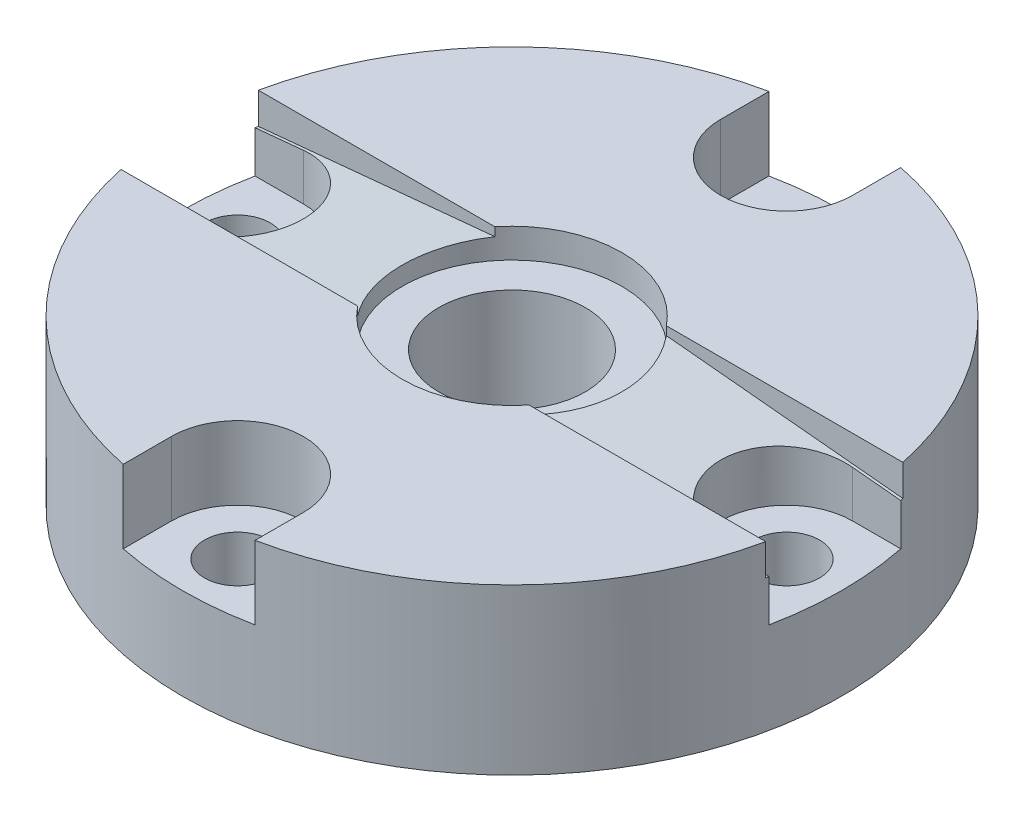
from build123d import *

# Parameters (mm, degrees)
ESQUISSE1_R                  = 90
BOSS_EXTRU_1_DEPTH           = 45
ESQUISSE2_R                  = 9
ENL_V_MAT_EXTRU_1_DEPTH      = 45
ESQUISSE2_3_R                = 9
ENL_V_MAT_EXTRU_2_DEPTH      = 20
ENL_V_MAT_EXTRU_3_DEPTH      = 18.75
R_P_TITION_CIRCULAIRE2_COUNT = 4
ESQUISSE4_R                  = 30
ENL_V_MAT_EXTRU_4_DEPTH      = 8
ESQUISSE4_3_R                = 20
ENL_V_MAT_EXTRU_5_DEPTH      = 136


with BuildPart() as part:
    # Esquisse1 → Boss.-Extru.1 (new body)
    with BuildSketch(Plane(origin=(0, 0, 0), x_dir=(1, 0, 0), z_dir=(0, 1, 0))):
        Circle(ESQUISSE1_R)
    extrude(amount=BOSS_EXTRU_1_DEPTH)

    # Esquisse2 → Enlèv. mat.-Extru.1 (cut)
    with BuildSketch(Plane(origin=(0, 45, 0), x_dir=(1, 0, 0), z_dir=(0, 1, 0))):
        with Locations((75, 0)):
            Circle(ESQUISSE2_R)
    enl_v_mat_extru_1 = extrude(amount=-ENL_V_MAT_EXTRU_1_DEPTH, mode=Mode.SUBTRACT)

    # Esquisse2<3> → Enlèv. mat.-Extru.2 (cut)
    with BuildSketch(Plane(origin=(0, 45, 0), x_dir=(1, 0, 0), z_dir=(0, 1, 0))):
        with BuildLine():
            Line((75, 18), (115, 18))
            ThreePointArc((115, 18), (133, 0), (115, -18))
            Line((115, -18), (75, -18))
            ThreePointArc((75, -18), (57, 0), (75, 18))
        make_face()
        with Locations((75, 0)):
            Circle(ESQUISSE2_3_R, mode=Mode.SUBTRACT)
    enl_v_mat_extru_2 = extrude(amount=-ENL_V_MAT_EXTRU_2_DEPTH, mode=Mode.SUBTRACT)

    # Esquisse3 → Enlèv. mat.-Extru.3 (cut, symmetric)
    with BuildSketch(Plane.XY):
        Polygon((-0.90918463, 45), (101.87081537, 35.103411626), (101.87081537, 45), align=None)
    enl_v_mat_extru_3 = extrude(amount=ENL_V_MAT_EXTRU_3_DEPTH, both=True, mode=Mode.SUBTRACT)

    # Symétrie1: Enlèv. mat.-Extru.3 across plane
    add(enl_v_mat_extru_3.mirror(Plane(origin=(0, 0, 0), x_dir=(0, 0, 1), z_dir=(1, 0, 0))), mode=Mode.SUBTRACT)

    # Répétition circulaire2: Enlèv. mat.-Extru.1, Enlèv. mat.-Extru.2 ×4 about axis
    r_p_tition_circulaire2_axis = Axis((0, 0, 0), (0, 1, 0))
    add([enl_v_mat_extru_1.rotate(r_p_tition_circulaire2_axis, i * 360 / R_P_TITION_CIRCULAIRE2_COUNT) for i in range(1, R_P_TITION_CIRCULAIRE2_COUNT)], mode=Mode.SUBTRACT)
    add([enl_v_mat_extru_2.rotate(r_p_tition_circulaire2_axis, i * 360 / R_P_TITION_CIRCULAIRE2_COUNT) for i in range(1, R_P_TITION_CIRCULAIRE2_COUNT)], mode=Mode.SUBTRACT)

    # Esquisse4 → Enlèv. mat.-Extru.4 (cut, symmetric)
    with BuildSketch(Plane(origin=(0, 45, 0), x_dir=(1, 0, 0), z_dir=(0, 1, 0))):
        Circle(ESQUISSE4_R)
    extrude(amount=ENL_V_MAT_EXTRU_4_DEPTH, both=True, mode=Mode.SUBTRACT)

    # Esquisse4<3> → Enlèv. mat.-Extru.5 (cut, through all)
    with BuildSketch(Plane(origin=(0, 45, 0), x_dir=(1, 0, 0), z_dir=(0, 1, 0))):
        Circle(ESQUISSE4_3_R)
    extrude(amount=-ENL_V_MAT_EXTRU_5_DEPTH, mode=Mode.SUBTRACT)


solid = part.part
